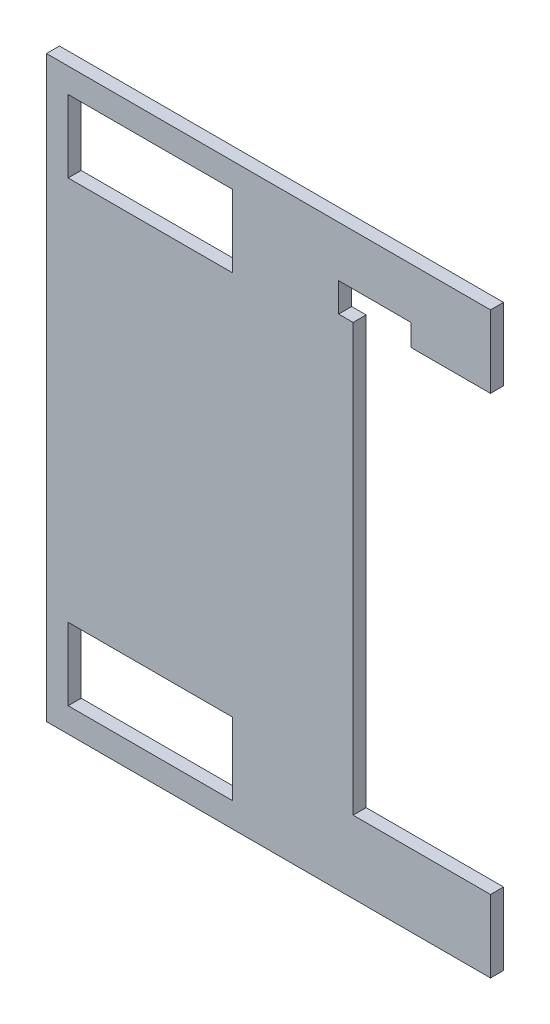
from build123d import *

# Parameters (mm, degrees)
SKETCH1_W           = 306.999208532
SKETCH1_H           = 400
SKETCH1_W_2         = 113.639208532
SKETCH1_H_2         = 50
BOSS_EXTRUDE1_DEPTH = 9
SKETCH2_W           = 95
SKETCH2_H           = 300
CUT_EXTRUDE1_DEPTH  = 460.151907085
SKETCH3_W           = 40
SKETCH3_H           = 15
CUT_EXTRUDE2_DEPTH  = 10
SKETCH4_W           = 10
SKETCH4_H           = 20
CUT_EXTRUDE3_DEPTH  = 100


with BuildPart() as part:
    # Sketch1 → Boss-Extrude1 (new body)
    with BuildSketch(Plane.XY):
        with Locations((-170.312553906, 125.4)):
            Rectangle(SKETCH1_W, SKETCH1_H)
        with Locations((-251.992553906, 283.4)):
            Rectangle(SKETCH1_W_2, SKETCH1_H_2, mode=Mode.SUBTRACT)
        with Locations((-251.992553906, -32.6)):
            Rectangle(SKETCH1_W_2, SKETCH1_H_2, mode=Mode.SUBTRACT)
    extrude(amount=BOSS_EXTRUDE1_DEPTH)

    # Sketch2 → Cut-Extrude1 (cut, through all)
    with BuildSketch(Plane(origin=(0, 0, 0), x_dir=(-1, 0, 0), z_dir=(0, 0, -1))):
        with Locations((64.31294964, 125.4)):
            Rectangle(SKETCH2_W, SKETCH2_H)
    extrude(amount=-CUT_EXTRUDE1_DEPTH, mode=Mode.SUBTRACT)

    # Sketch3 → Cut-Extrude2 (cut)
    with BuildSketch(Plane(origin=(0, 0, 0), x_dir=(-1, 0, 0), z_dir=(0, 0, -1))):
        with Locations((91.81294964, 282.9)):
            Rectangle(SKETCH3_W, SKETCH3_H)
    extrude(amount=-CUT_EXTRUDE2_DEPTH, mode=Mode.SUBTRACT)

    # Sketch4 → Cut-Extrude3 (cut)
    with BuildSketch(Plane(origin=(0, 0, 0), x_dir=(-1, 0, 0), z_dir=(0, 0, -1))):
        with Locations((116.81294964, 280.4)):
            Rectangle(SKETCH4_W, SKETCH4_H)
    extrude(amount=-CUT_EXTRUDE3_DEPTH, mode=Mode.SUBTRACT)


solid = part.part
